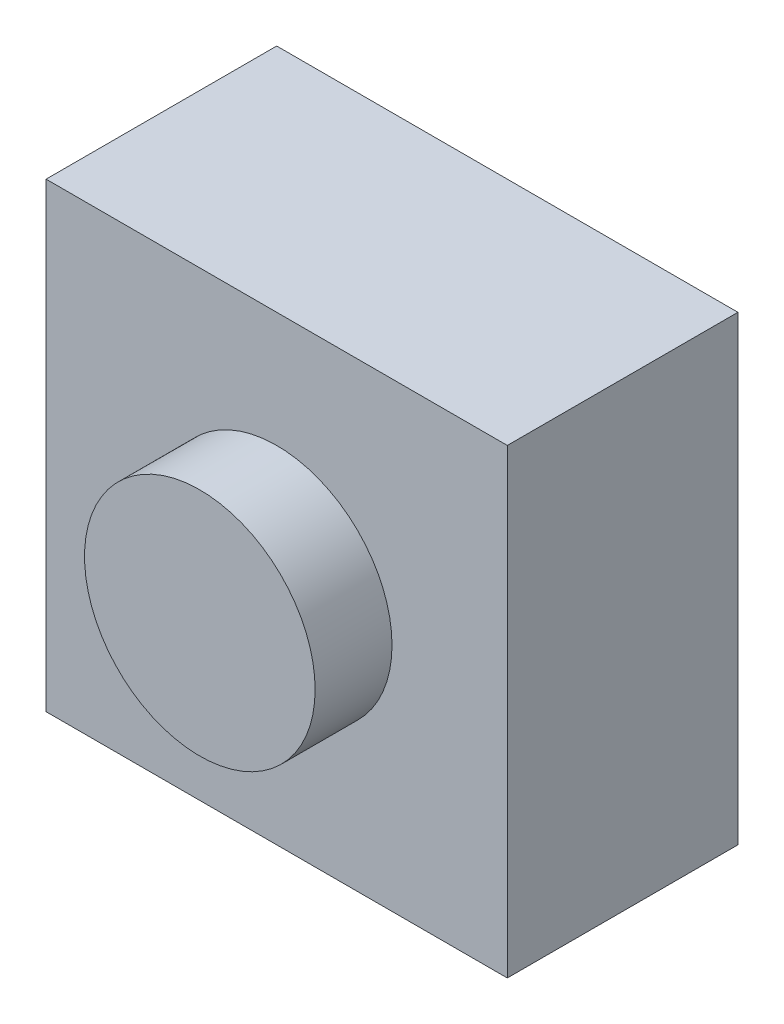
from build123d import *

# Parameters (mm, degrees)
SKETCH_1_W      = 6
SKETCH_1_H      = 6
EXTRUDE_1_DEPTH = 3
SKETCH_1_3_R    = 1.5
EXTRUDE_2_DEPTH = 4


with BuildPart() as part:
    # Эскиз1 → Бобышка-Вытянуть1 (new body)
    with BuildSketch(Plane.XY):
        with Locations((-3, 3)):
            Rectangle(SKETCH_1_W, SKETCH_1_H)
    extrude(amount=EXTRUDE_1_DEPTH)

    # Эскиз1<3> → Бобышка-Вытянуть2 (add)
    with BuildSketch(Plane.XY):
        with Locations((-3, 3)):
            Circle(SKETCH_1_3_R)
    extrude(amount=EXTRUDE_2_DEPTH)


solid = part.part
